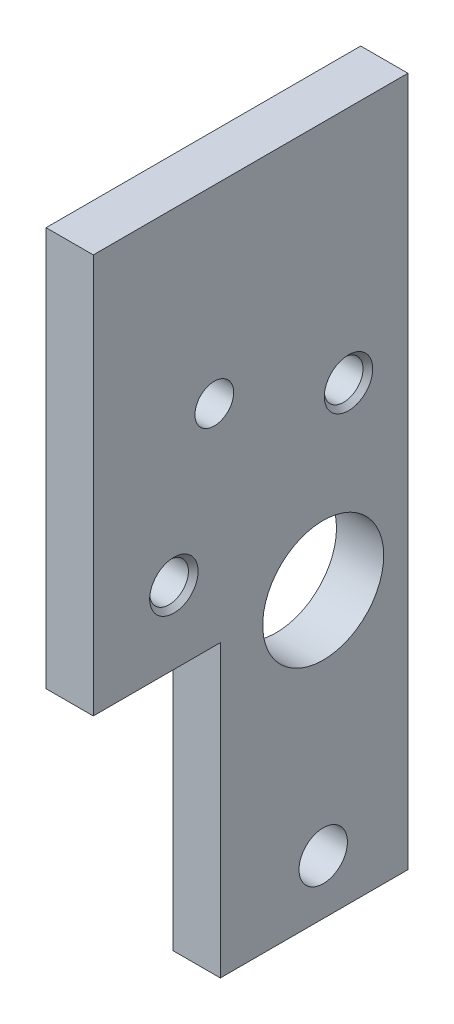
from build123d import *

# Parameters (mm, degrees)
SKETCH1_W                                        = 30
SKETCH1_H                                        = 57
BOSS_EXTRUDE1_DEPTH                              = 3.9
SKETCH2_R                                        = 5
CUT_EXTRUDE1_DEPTH                               = 65.530690373
F_4_0_4_DIAMETER_HOLE1_D                         = 4
SKETCH12_W                                       = 14.5
SKETCH12_H                                       = 24
CUT_EXTRUDE2_DEPTH                               = 65.530690373
CBORE_FOR_M3_PAN_HEAD_MACHINE_SCREW2_D           = 3.2
CBORE_FOR_M3_PAN_HEAD_MACHINE_SCREW2_CBORE_D     = 9
CBORE_FOR_M3_PAN_HEAD_MACHINE_SCREW2_CBORE_DEPTH = 1
CSK_FOR_M3_FLAT_HEAD_MACHINE_SCREW1_D            = 3.2
CSK_FOR_M3_FLAT_HEAD_MACHINE_SCREW1_CSINK_D      = 4
CSK_FOR_M3_FLAT_HEAD_MACHINE_SCREW1_CSINK_ANGLE  = 90
SKETCH19_W                                       = 4
SKETCH19_H                                       = 33
CUT_EXTRUDE3_DEPTH                               = 65.530690373


with BuildPart() as part:
    # Sketch1 → Boss-Extrude1 (new body)
    with BuildSketch(Plane(origin=(0, 0, 0), x_dir=(0, 0, -1), z_dir=(1, 0, 0))):
        with Locations((-15, 28.5)):
            Rectangle(SKETCH1_W, SKETCH1_H)
    extrude(amount=-BOSS_EXTRUDE1_DEPTH)

    # Sketch2 → Cut-Extrude1 (cut, through all)
    with BuildSketch(Plane(origin=(0, 0, 0), x_dir=(0, 0, -1), z_dir=(1, 0, 0))):
        with Locations((-7, 23.5)):
            Circle(SKETCH2_R)
    extrude(amount=-CUT_EXTRUDE1_DEPTH, mode=Mode.SUBTRACT)

    # Ø4.0 (4) Diameter Hole1 (through all)
    with Locations(Plane(origin=(0, 4.5, 7), x_dir=(0, 0, 1), z_dir=(1, 0, 0))):
        with Locations((0, 0)):
            Hole(F_4_0_4_DIAMETER_HOLE1_D / 2)

    # Sketch12 → Cut-Extrude2 (cut, through all)
    with BuildSketch(Plane(origin=(0, 0, 0), x_dir=(0, 0, -1), z_dir=(1, 0, 0))):
        with Locations((-22.75, 12)):
            Rectangle(SKETCH12_W, SKETCH12_H)
    extrude(amount=-CUT_EXTRUDE2_DEPTH, mode=Mode.SUBTRACT)

    # CBORE for M3 Pan Head Machine Screw2 (through all)
    with Locations(Plane(origin=(-3.9, 41.360571099, 16), x_dir=(0, 0, -1), z_dir=(-1, 0, 0))):
        with Locations((0, 0)):
            CounterBoreHole(CBORE_FOR_M3_PAN_HEAD_MACHINE_SCREW2_D / 2, CBORE_FOR_M3_PAN_HEAD_MACHINE_SCREW2_CBORE_D / 2, CBORE_FOR_M3_PAN_HEAD_MACHINE_SCREW2_CBORE_DEPTH)

    # CSK for M3 Flat Head Machine Screw1 (through all)
    with Locations(Plane(origin=(0, 30.032608687, 19.33966579), x_dir=(0, 0, 1), z_dir=(1, 0, 0))):
        with Locations((0, 0), (-14.431341448, -7.272)):
            CounterSinkHole(CSK_FOR_M3_FLAT_HEAD_MACHINE_SCREW1_D / 2, CSK_FOR_M3_FLAT_HEAD_MACHINE_SCREW1_CSINK_D / 2, counter_sink_angle=CSK_FOR_M3_FLAT_HEAD_MACHINE_SCREW1_CSINK_ANGLE)

    # Sketch19 → Cut-Extrude3 (cut, through all)
    with BuildSketch(Plane.ZY.offset(3.9)):
        with Locations((28, 40.5)):
            Rectangle(SKETCH19_W, SKETCH19_H)
    extrude(amount=-CUT_EXTRUDE3_DEPTH, mode=Mode.SUBTRACT)


solid = part.part
